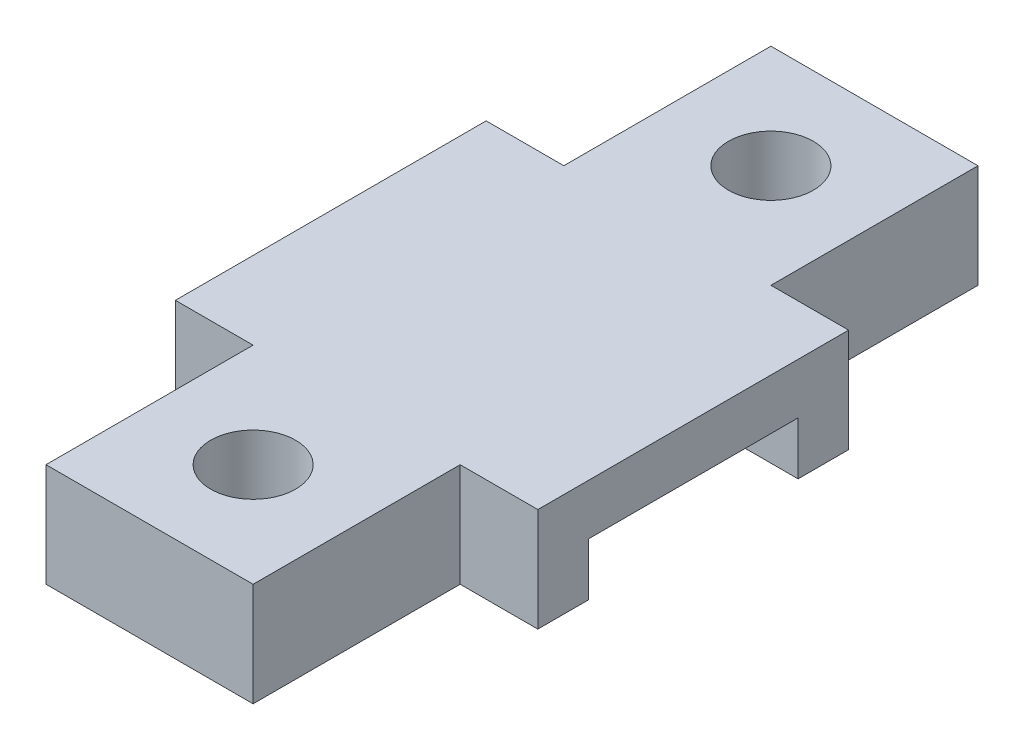
from build123d import *

# Parameters (mm, degrees)
SKETCH1_W                = 20
SKETCH1_H                = 70
BOSS_EXTRUDE1_DEPTH      = 10
CUT_EXTRUDE1_DEPTH       = 42.533119315
CUT_EXTRUDE1_DEPTH_BACK  = 42.533119315
SKETCH2_W                = 20.25
SKETCH2_H                = 5.1
SKETCH3_R                = 4.1
CUT_EXTRUDE2_DEPTH       = 38.749172176
BOSS_EXTRUDE2_DEPTH      = 7.5
BOSS_EXTRUDE2_DEPTH_BACK = 27.5


with BuildPart() as part:
    # Sketch1 → Boss-Extrude1 (new body)
    with BuildSketch(Plane(origin=(0, 0, 0), x_dir=(1, 0, 0), z_dir=(0, 1, 0))):
        Rectangle(SKETCH1_W, SKETCH1_H)
    extrude(amount=BOSS_EXTRUDE1_DEPTH)

    # Sketch2 → Cut-Extrude1 (cut, two sides: drawn at the far end of the back side and taken through both)
    with BuildSketch(Plane(origin=(10, 0, 0), x_dir=(0, 0, -1), z_dir=(1, 0, 0)).offset(-CUT_EXTRUDE1_DEPTH_BACK)):
        with Locations((0, 2.55)):
            Rectangle(SKETCH2_W, SKETCH2_H)
    extrude(amount=CUT_EXTRUDE1_DEPTH + CUT_EXTRUDE1_DEPTH_BACK, mode=Mode.SUBTRACT)

    # Sketch3 → Cut-Extrude2 (cut, through all)
    with BuildSketch(Plane.XZ):
        with Locations(Location((0, 25, 0), (0, 0, 270))):
            Circle(SKETCH3_R)
        with Locations(Location((0, -25, 0), (0, 0, 270))):
            Circle(SKETCH3_R)
    extrude(amount=-CUT_EXTRUDE2_DEPTH, mode=Mode.SUBTRACT)

    # Sketch4 → Boss-Extrude2 (add, two sides: drawn at the far end of the back side and taken through both)
    with BuildSketch(Plane(origin=(10, 0, 0), x_dir=(0, 0, -1), z_dir=(1, 0, 0)).offset(-BOSS_EXTRUDE2_DEPTH_BACK)):
        Polygon((-10.125, 0), (-15.005, 0), (-15.005, 10), (15.005, 10), (15.005, 0), (10.125, 0), (10.125, 5.1), (-10.125, 5.1), align=None)
    extrude(amount=BOSS_EXTRUDE2_DEPTH + BOSS_EXTRUDE2_DEPTH_BACK)


solid = part.part
